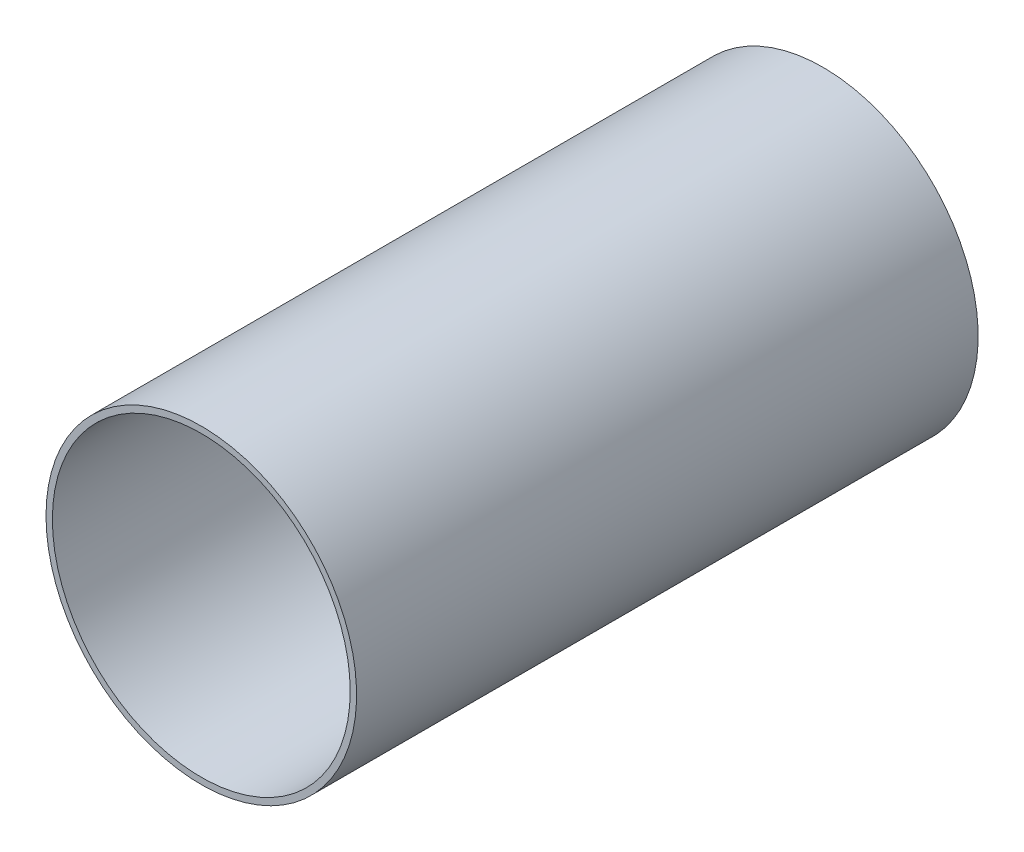
from build123d import *

# Parameters (mm, degrees)
SKETCH1_R           = 38.0746
SKETCH1_R_2         = 36.5125
BOSS_EXTRUDE1_DEPTH = 152.4


with BuildPart() as part:
    # Sketch1 → Boss-Extrude1 (new body)
    with BuildSketch(Plane.XY):
        with Locations(Location((0, 0, 0), (0, 0, 180))):
            Circle(SKETCH1_R)
        with Locations(Location((0, 0, 0), (0, 0, 180))):
            Circle(SKETCH1_R_2, mode=Mode.SUBTRACT)
    extrude(amount=BOSS_EXTRUDE1_DEPTH)


solid = part.part
